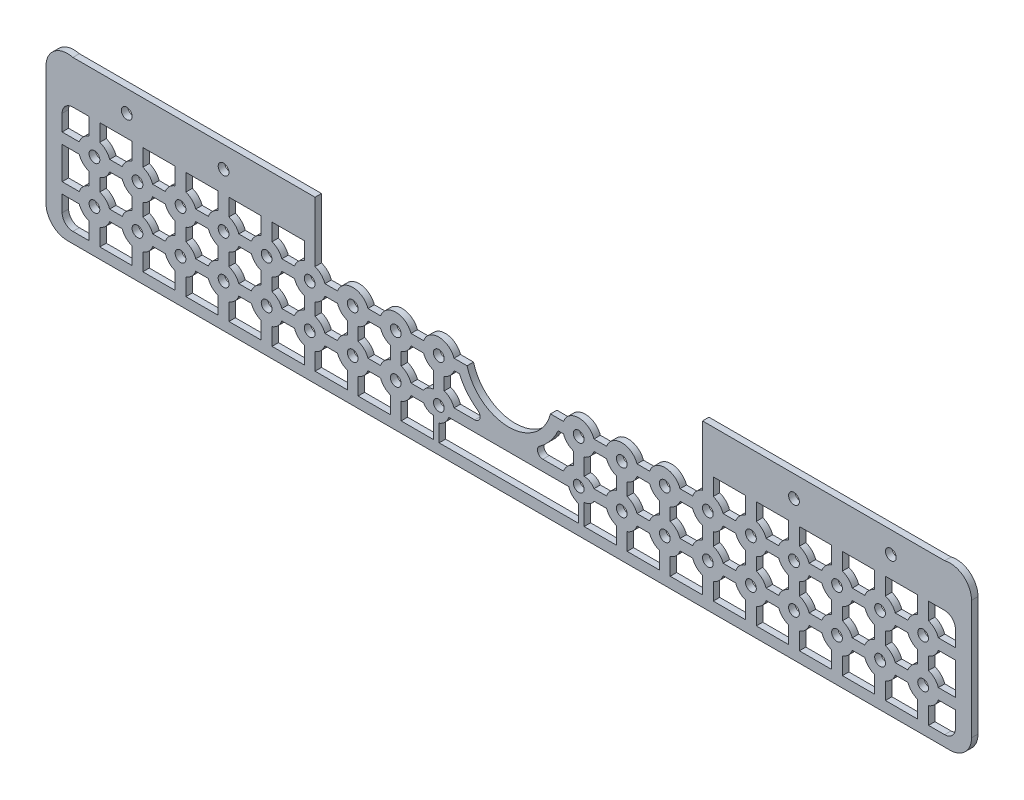
from build123d import *

# Parameters (mm, degrees)
SKETCH1_R           = 5
BOSS_EXTRUDE1_DEPTH = 6


with BuildPart() as part:
    # Sketch1 → Boss-Extrude1 (new body)
    with BuildSketch(Plane.XY):
        with BuildLine():
            Line((-429.999669519, -55), (-429.999669519, 55.634997942))
            ThreePointArc((-429.999669519, 55.634997942), (-422.24725315, 71.446281735), (-405, 75))
            Line((-405, 75), (-180, 75))
            Line((-180, 75), (-180, 35))
            Line((-180, 35), (-180, 19.142135624))
            ThreePointArc((-180, 19.142135624), (-174.393398282, 15.606601718), (-170.857864376, 10))
            Line((-170.857864376, 10), (-159.142135624, 10))
            ThreePointArc((-159.142135624, 10), (-155.606601718, 15.606601718), (-150, 19.142135624))
            ThreePointArc((-150, 19.142135624), (-145, 20), (-140, 19.142135624))
            ThreePointArc((-140, 19.142135624), (-134.393398282, 15.606601718), (-130.857864376, 10))
            Line((-130.857864376, 10), (-119.142135624, 10))
            ThreePointArc((-119.142135624, 10), (-115.606601718, 15.606601718), (-110, 19.142135624))
            ThreePointArc((-110, 19.142135624), (-105, 20), (-100, 19.142135624))
            ThreePointArc((-100, 19.142135624), (-94.393398282, 15.606601718), (-90.857864376, 10))
            Line((-90.857864376, 10), (-79.142135624, 10))
            ThreePointArc((-79.142135624, 10), (-75.606601718, 15.606601718), (-70, 19.142135624))
            ThreePointArc((-70, 19.142135624), (-65, 20), (-60, 19.142135624))
            ThreePointArc((-60, 19.142135624), (-54.393398282, 15.606601718), (-50.857864376, 10))
            Line((-50.857864376, 10), (-48.989794856, 10))
            Line((-48.989794856, 10), (-38.729833462, 10))
            ThreePointArc((-38.729833462, 10), (-24.494897428, -11.622776602), (0, -20))
            Line((0, -20), (0, -40))
            Line((0, -40), (-55.70219982, -40))
            ThreePointArc((-55.70219982, -40), (-59.176916261, -45.596492425), (-64.698758144, -49.18865668))
            Line((-64.698758144, -49.18865668), (-64.698758144, -65))
            Line((-64.698758144, -65), (0, -65))
            Line((0, -65), (0, -75))
            Line((0, -75), (-409.999669519, -75))
            ThreePointArc((-409.999669519, -75), (-424.141805142, -69.142135624), (-429.999669519, -55))
        make_face()
        with Locations((-385, 5)):
            Circle(SKETCH1_R, mode=Mode.SUBTRACT)
        with Locations((-354.999669519, 55)):
            Circle(SKETCH1_R, mode=Mode.SUBTRACT)
        with Locations((-265, 55)):
            Circle(SKETCH1_R, mode=Mode.SUBTRACT)
        with Locations(Location((-385, -35, 0), (0, 0, 180))):
            Circle(SKETCH1_R, mode=Mode.SUBTRACT)
        with Locations((-345, 5)):
            Circle(SKETCH1_R, mode=Mode.SUBTRACT)
        with Locations(Location((-345, -35, 0), (0, 0, 180))):
            Circle(SKETCH1_R, mode=Mode.SUBTRACT)
        with Locations((-305, 5)):
            Circle(SKETCH1_R, mode=Mode.SUBTRACT)
        with Locations(Location((-305, -35, 0), (0, 0, 180))):
            Circle(SKETCH1_R, mode=Mode.SUBTRACT)
        with Locations((-265, 5)):
            Circle(SKETCH1_R, mode=Mode.SUBTRACT)
        with Locations(Location((-265, -35, 0), (0, 0, 180))):
            Circle(SKETCH1_R, mode=Mode.SUBTRACT)
        with Locations((-225, 5)):
            Circle(SKETCH1_R, mode=Mode.SUBTRACT)
        with Locations(Location((-225, -35, 0), (0, 0, 180))):
            Circle(SKETCH1_R, mode=Mode.SUBTRACT)
        with Locations((-185, 5)):
            Circle(SKETCH1_R, mode=Mode.SUBTRACT)
        with Locations(Location((-185, -35, 0), (0, 0, 180))):
            Circle(SKETCH1_R, mode=Mode.SUBTRACT)
        with Locations((-145, 5)):
            Circle(SKETCH1_R, mode=Mode.SUBTRACT)
        with Locations(Location((-145, -35, 0), (0, 0, 180))):
            Circle(SKETCH1_R, mode=Mode.SUBTRACT)
        with Locations((-105, 5)):
            Circle(SKETCH1_R, mode=Mode.SUBTRACT)
        with Locations(Location((-105, -35, 0), (0, 0, 180))):
            Circle(SKETCH1_R, mode=Mode.SUBTRACT)
        with Locations((-65, 5)):
            Circle(SKETCH1_R, mode=Mode.SUBTRACT)
        with Locations(Location((-65, -35, 0), (0, 0, 180))):
            Circle(SKETCH1_R, mode=Mode.SUBTRACT)
        with BuildLine():
            Line((-415, -55), (-415, -40))
            Line((-415, -40), (-399.142135624, -40))
            ThreePointArc((-399.142135624, -40), (-395.606601718, -45.606601718), (-390, -49.142135624))
            Line((-390, -49.142135624), (-390, -65))
            Line((-390, -65), (-405, -65))
            ThreePointArc((-405, -65), (-412.071067812, -62.071067812), (-415, -55))
        make_face(mode=Mode.SUBTRACT)
        with BuildLine():
            Line((-405, 35), (-390, 35))
            Line((-390, 35), (-390, 19.142135624))
            ThreePointArc((-390, 19.142135624), (-395.606601718, 15.606601718), (-399.142135624, 10))
            Line((-399.142135624, 10), (-415, 10))
            Line((-415, 10), (-415, 25))
            ThreePointArc((-415, 25), (-412.071067812, 32.071067812), (-405, 35))
        make_face(mode=Mode.SUBTRACT)
        with BuildLine():
            Line((-380, 19.142135624), (-380, 35))
            Line((-380, 35), (-350, 35))
            Line((-350, 35), (-350, 19.142135624))
            ThreePointArc((-350, 19.142135624), (-355.606601718, 15.606601718), (-359.142135624, 10))
            Line((-359.142135624, 10), (-370.857864376, 10))
            ThreePointArc((-370.857864376, 10), (-374.393398282, 15.606601718), (-380, 19.142135624))
        make_face(mode=Mode.SUBTRACT)
        with BuildLine():
            Line((-399.142135624, 0), (-415, 0))
            Line((-415, 0), (-415, -30))
            Line((-415, -30), (-399.142135624, -30))
            ThreePointArc((-399.142135624, -30), (-395.606601718, -24.393398282), (-390, -20.857864376))
            Line((-390, -20.857864376), (-390, -9.142135624))
            ThreePointArc((-390, -9.142135624), (-395.606601718, -5.606601718), (-399.142135624, 0))
        make_face(mode=Mode.SUBTRACT)
        with BuildLine():
            Line((-380, -49.142135624), (-380, -65))
            Line((-380, -65), (-350, -65))
            Line((-350, -65), (-350, -49.142135624))
            ThreePointArc((-350, -49.142135624), (-355.606601718, -45.606601718), (-359.142135624, -40))
            Line((-359.142135624, -40), (-370.857864376, -40))
            ThreePointArc((-370.857864376, -40), (-374.393398282, -45.606601718), (-380, -49.142135624))
        make_face(mode=Mode.SUBTRACT)
        with BuildLine():
            Line((-380, -9.142135624), (-380, -20.857864376))
            ThreePointArc((-380, -20.857864376), (-374.393398282, -24.393398282), (-370.857864376, -30))
            Line((-370.857864376, -30), (-359.142135624, -30))
            ThreePointArc((-359.142135624, -30), (-355.606601718, -24.393398282), (-350, -20.857864376))
            Line((-350, -20.857864376), (-350, -9.142135624))
            ThreePointArc((-350, -9.142135624), (-355.606601718, -5.606601718), (-359.142135624, 0))
            Line((-359.142135624, 0), (-370.857864376, 0))
            ThreePointArc((-370.857864376, 0), (-374.393398282, -5.606601718), (-380, -9.142135624))
        make_face(mode=Mode.SUBTRACT)
        with BuildLine():
            Line((-340, 19.142135624), (-340, 35))
            Line((-340, 35), (-310, 35))
            Line((-310, 35), (-310, 19.142135624))
            ThreePointArc((-310, 19.142135624), (-315.606601718, 15.606601718), (-319.142135624, 10))
            Line((-319.142135624, 10), (-330.857864376, 10))
            ThreePointArc((-330.857864376, 10), (-334.393398282, 15.606601718), (-340, 19.142135624))
        make_face(mode=Mode.SUBTRACT)
        with BuildLine():
            Line((-340, -49.142135624), (-340, -65))
            Line((-340, -65), (-310, -65))
            Line((-310, -65), (-310, -49.142135624))
            ThreePointArc((-310, -49.142135624), (-315.606601718, -45.606601718), (-319.142135624, -40))
            Line((-319.142135624, -40), (-330.857864376, -40))
            ThreePointArc((-330.857864376, -40), (-334.393398282, -45.606601718), (-340, -49.142135624))
        make_face(mode=Mode.SUBTRACT)
        with BuildLine():
            Line((-340, -9.142135624), (-340, -20.857864376))
            ThreePointArc((-340, -20.857864376), (-334.393398282, -24.393398282), (-330.857864376, -30))
            Line((-330.857864376, -30), (-319.142135624, -30))
            ThreePointArc((-319.142135624, -30), (-315.606601718, -24.393398282), (-310, -20.857864376))
            Line((-310, -20.857864376), (-310, -9.142135624))
            ThreePointArc((-310, -9.142135624), (-315.606601718, -5.606601718), (-319.142135624, 0))
            Line((-319.142135624, 0), (-330.857864376, 0))
            ThreePointArc((-330.857864376, 0), (-334.393398282, -5.606601718), (-340, -9.142135624))
        make_face(mode=Mode.SUBTRACT)
        with BuildLine():
            Line((-300, 19.142135624), (-300, 35))
            Line((-300, 35), (-270, 35))
            Line((-270, 35), (-270, 19.142135624))
            ThreePointArc((-270, 19.142135624), (-275.606601718, 15.606601718), (-279.142135624, 10))
            Line((-279.142135624, 10), (-290.857864376, 10))
            ThreePointArc((-290.857864376, 10), (-294.393398282, 15.606601718), (-300, 19.142135624))
        make_face(mode=Mode.SUBTRACT)
        with BuildLine():
            Line((-300, -9.142135624), (-300, -20.857864376))
            ThreePointArc((-300, -20.857864376), (-294.393398282, -24.393398282), (-290.857864376, -30))
            Line((-290.857864376, -30), (-279.142135624, -30))
            ThreePointArc((-279.142135624, -30), (-275.606601718, -24.393398282), (-270, -20.857864376))
            Line((-270, -20.857864376), (-270, -9.142135624))
            ThreePointArc((-270, -9.142135624), (-275.606601718, -5.606601718), (-279.142135624, 0))
            Line((-279.142135624, 0), (-290.857864376, 0))
            ThreePointArc((-290.857864376, 0), (-294.393398282, -5.606601718), (-300, -9.142135624))
        make_face(mode=Mode.SUBTRACT)
        with BuildLine():
            Line((-300, -49.142135624), (-300, -65))
            Line((-300, -65), (-270, -65))
            Line((-270, -65), (-270, -49.142135624))
            ThreePointArc((-270, -49.142135624), (-275.606601718, -45.606601718), (-279.142135624, -40))
            Line((-279.142135624, -40), (-290.857864376, -40))
            ThreePointArc((-290.857864376, -40), (-294.393398282, -45.606601718), (-300, -49.142135624))
        make_face(mode=Mode.SUBTRACT)
        with BuildLine():
            Line((-260, 19.142135624), (-260, 35))
            Line((-260, 35), (-230, 35))
            Line((-230, 35), (-230, 19.142135624))
            ThreePointArc((-230, 19.142135624), (-235.606601718, 15.606601718), (-239.142135624, 10))
            Line((-239.142135624, 10), (-250.857864376, 10))
            ThreePointArc((-250.857864376, 10), (-254.393398282, 15.606601718), (-260, 19.142135624))
        make_face(mode=Mode.SUBTRACT)
        with BuildLine():
            Line((-260, -9.142135624), (-260, -20.857864376))
            ThreePointArc((-260, -20.857864376), (-254.393398282, -24.393398282), (-250.857864376, -30))
            Line((-250.857864376, -30), (-239.142135624, -30))
            ThreePointArc((-239.142135624, -30), (-235.606601718, -24.393398282), (-230, -20.857864376))
            Line((-230, -20.857864376), (-230, -9.142135624))
            ThreePointArc((-230, -9.142135624), (-235.606601718, -5.606601718), (-239.142135624, 0))
            Line((-239.142135624, 0), (-250.857864376, 0))
            ThreePointArc((-250.857864376, 0), (-254.393398282, -5.606601718), (-260, -9.142135624))
        make_face(mode=Mode.SUBTRACT)
        with BuildLine():
            Line((-260, -49.142135624), (-260, -65))
            Line((-260, -65), (-230, -65))
            Line((-230, -65), (-230, -49.142135624))
            ThreePointArc((-230, -49.142135624), (-235.606601718, -45.606601718), (-239.142135624, -40))
            Line((-239.142135624, -40), (-250.857864376, -40))
            ThreePointArc((-250.857864376, -40), (-254.393398282, -45.606601718), (-260, -49.142135624))
        make_face(mode=Mode.SUBTRACT)
        with BuildLine():
            Line((-220, 19.142135624), (-220, 35))
            Line((-220, 35), (-190, 35))
            Line((-190, 35), (-190, 19.142135624))
            ThreePointArc((-190, 19.142135624), (-195.606601718, 15.606601718), (-199.142135624, 10))
            Line((-199.142135624, 10), (-210.857864376, 10))
            ThreePointArc((-210.857864376, 10), (-214.393398282, 15.606601718), (-220, 19.142135624))
        make_face(mode=Mode.SUBTRACT)
        with BuildLine():
            Line((-220, -9.142135624), (-220, -20.857864376))
            ThreePointArc((-220, -20.857864376), (-214.393398282, -24.393398282), (-210.857864376, -30))
            Line((-210.857864376, -30), (-199.142135624, -30))
            ThreePointArc((-199.142135624, -30), (-195.606601718, -24.393398282), (-190, -20.857864376))
            Line((-190, -20.857864376), (-190, -9.142135624))
            ThreePointArc((-190, -9.142135624), (-195.606601718, -5.606601718), (-199.142135624, 0))
            Line((-199.142135624, 0), (-210.857864376, 0))
            ThreePointArc((-210.857864376, 0), (-214.393398282, -5.606601718), (-220, -9.142135624))
        make_face(mode=Mode.SUBTRACT)
        with BuildLine():
            Line((-220, -49.142135624), (-220, -65))
            Line((-220, -65), (-190, -65))
            Line((-190, -65), (-190, -49.142135624))
            ThreePointArc((-190, -49.142135624), (-195.606601718, -45.606601718), (-199.142135624, -40))
            Line((-199.142135624, -40), (-210.857864376, -40))
            ThreePointArc((-210.857864376, -40), (-214.393398282, -45.606601718), (-220, -49.142135624))
        make_face(mode=Mode.SUBTRACT)
        with BuildLine():
            Line((-180, -9.142135624), (-180, -20.857864376))
            ThreePointArc((-180, -20.857864376), (-174.393398282, -24.393398282), (-170.857864376, -30))
            Line((-170.857864376, -30), (-159.142135624, -30))
            ThreePointArc((-159.142135624, -30), (-155.606601718, -24.393398282), (-150, -20.857864376))
            Line((-150, -20.857864376), (-150, -9.142135624))
            ThreePointArc((-150, -9.142135624), (-155.606601718, -5.606601718), (-159.142135624, 0))
            Line((-159.142135624, 0), (-170.857864376, 0))
            ThreePointArc((-170.857864376, 0), (-174.393398282, -5.606601718), (-180, -9.142135624))
        make_face(mode=Mode.SUBTRACT)
        with BuildLine():
            Line((-180, -49.142135624), (-180, -65))
            Line((-180, -65), (-150, -65))
            Line((-150, -65), (-150, -49.142135624))
            ThreePointArc((-150, -49.142135624), (-155.606601718, -45.606601718), (-159.142135624, -40))
            Line((-159.142135624, -40), (-170.857864376, -40))
            ThreePointArc((-170.857864376, -40), (-174.393398282, -45.606601718), (-180, -49.142135624))
        make_face(mode=Mode.SUBTRACT)
        with BuildLine():
            Line((-140, -9.142135624), (-140, -20.857864376))
            ThreePointArc((-140, -20.857864376), (-134.393398282, -24.393398282), (-130.857864376, -30))
            Line((-130.857864376, -30), (-119.142135624, -30))
            ThreePointArc((-119.142135624, -30), (-115.606601718, -24.393398282), (-110, -20.857864376))
            Line((-110, -20.857864376), (-110, -9.142135624))
            ThreePointArc((-110, -9.142135624), (-115.606601718, -5.606601718), (-119.142135624, 0))
            Line((-119.142135624, 0), (-130.857864376, 0))
            ThreePointArc((-130.857864376, 0), (-134.393398282, -5.606601718), (-140, -9.142135624))
        make_face(mode=Mode.SUBTRACT)
        with BuildLine():
            Line((-140, -49.142135624), (-140, -65))
            Line((-140, -65), (-110, -65))
            Line((-110, -65), (-110, -49.142135624))
            ThreePointArc((-110, -49.142135624), (-115.606601718, -45.606601718), (-119.142135624, -40))
            Line((-119.142135624, -40), (-130.857864376, -40))
            ThreePointArc((-130.857864376, -40), (-134.393398282, -45.606601718), (-140, -49.142135624))
        make_face(mode=Mode.SUBTRACT)
        with BuildLine():
            Line((-100, -9.142135624), (-100, -20.857864376))
            ThreePointArc((-100, -20.857864376), (-94.393398282, -24.393398282), (-90.857864376, -30))
            Line((-90.857864376, -30), (-79.142135624, -30))
            ThreePointArc((-79.142135624, -30), (-75.3140707, -26.036639773), (-70, -24.579602389))
            Line((-70, -24.579602389), (-70, -9.142135624))
            ThreePointArc((-70, -9.142135624), (-75.606601718, -5.606601718), (-79.142135624, 0))
            Line((-79.142135624, 0), (-90.857864376, 0))
            ThreePointArc((-90.857864376, 0), (-94.393398282, -5.606601718), (-100, -9.142135624))
        make_face(mode=Mode.SUBTRACT)
        with BuildLine():
            Line((-100, -49.142135624), (-100, -65))
            Line((-100, -65), (-70, -65))
            Line((-70, -65), (-70, -45.420397611))
            ThreePointArc((-70, -45.420397611), (-75.3140707, -43.963360227), (-79.142135624, -40))
            Line((-79.142135624, -40), (-90.857864376, -40))
            ThreePointArc((-90.857864376, -40), (-94.393398282, -45.606601718), (-100, -49.142135624))
        make_face(mode=Mode.SUBTRACT)
        with BuildLine():
            Line((-60, -9.142135624), (-60, -20.857864376))
            ThreePointArc((-60, -20.857864376), (-54.393398282, -24.393398282), (-50.857864376, -30))
            Line((-50.857864376, -30), (-31.622776602, -30))
            ThreePointArc((-31.622776602, -30), (-26.855463655, -26.507556723), (-28.747978729, -20.909090909))
            ThreePointArc((-28.747978729, -20.909090909), (-38.724772871, -11.628973522), (-45.82575695, 0))
            Line((-45.82575695, 0), (-50.857864376, 0))
            ThreePointArc((-50.857864376, 0), (-54.393398282, -5.606601718), (-60, -9.142135624))
        make_face(mode=Mode.SUBTRACT)
    boss_extrude1 = extrude(amount=BOSS_EXTRUDE1_DEPTH)

    # Mirror1: Boss-Extrude1 across plane
    add(boss_extrude1.mirror(Plane(origin=(0, -20, 6), x_dir=(0, 0, 1), z_dir=(-1, 0, 0))))


solid = part.part
